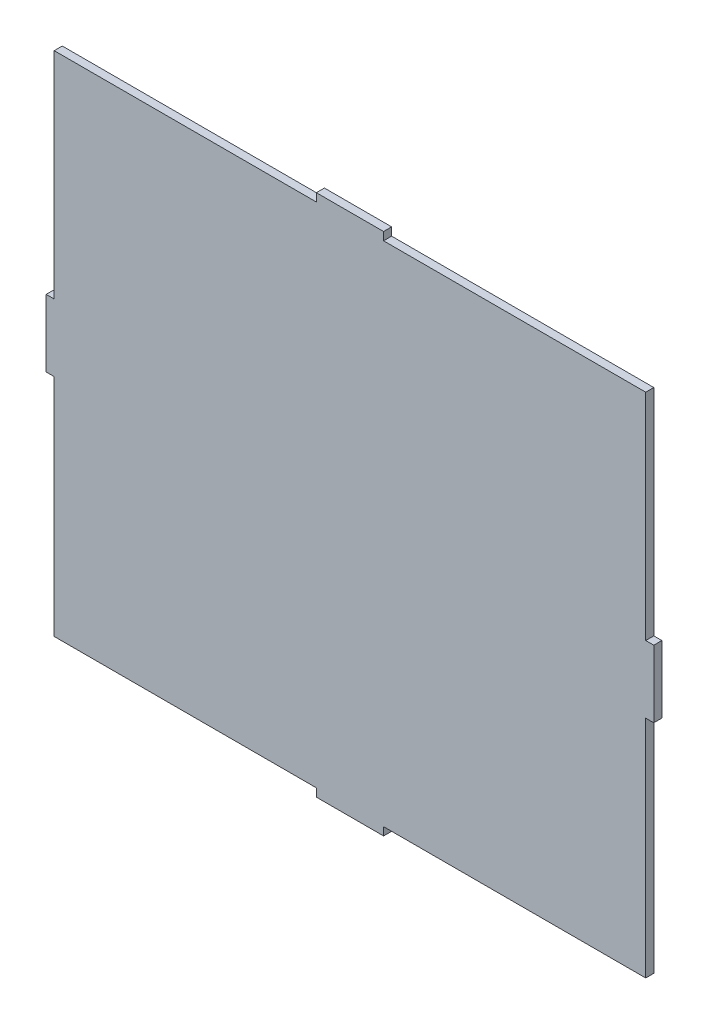
from build123d import *

# Parameters (mm, degrees)
EXTRUDE_1_DEPTH = 3


with BuildPart() as part:
    # Эскиз1 → Бобышка-Вытянуть1 (new body)
    with BuildSketch(Plane.XY):
        Polygon((-142.490880181, 187.230647897), (-44.990880181, 187.230647897), (-44.990880181, 107.230647897), (-41.990880181, 107.230647897), (-41.990880181, 82.230647897), (-44.990880181, 82.230647897), (-44.990880181, -1.469352103), (-142.490880181, -1.469352103), (-142.490880181, -4.469352103), (-167.490880181, -4.469352103), (-167.490880181, -1.469352103), (-264.990880181, -1.469352103), (-264.990880181, 82.230647897), (-267.990880181, 82.230647897), (-267.990880181, 107.230647897), (-264.990880181, 107.230647897), (-264.990880181, 187.230647897), (-167.490880181, 187.230647897), (-167.490880181, 190.230647897), (-142.490880181, 190.230647897), align=None)
    extrude(amount=EXTRUDE_1_DEPTH)


solid = part.part
